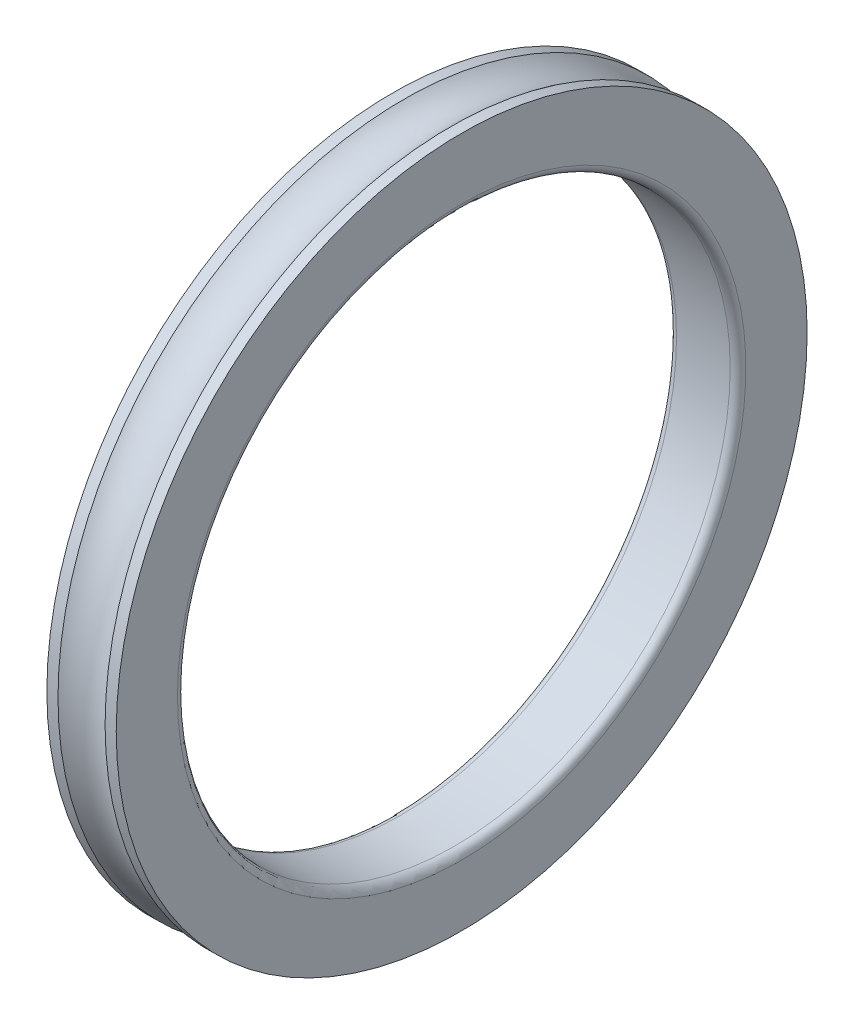
from build123d import *


with BuildPart() as part:
    # Sketch1 → Revolve1 (revolve)
    with BuildSketch(Plane.XY, mode=Mode.PRIVATE) as revolve1_sk:
        with BuildLine():
            Line((2.805064434, 27.94), (1.905, 27.94))
            ThreePointArc((1.905, 27.94), (0, 27.305), (-1.905, 27.94))
            Line((-1.905, 27.94), (-2.805064434, 27.94))
            Line((-2.805064434, 27.94), (-2.805064434, 22.987))
            ThreePointArc((-2.805064434, 22.987), (-2.61907724, 22.537987194), (-2.170064434, 22.352))
            Line((-2.170064434, 22.352), (2.170064434, 22.352))
            ThreePointArc((2.170064434, 22.352), (2.61907724, 22.537987194), (2.805064434, 22.987))
            Line((2.805064434, 22.987), (2.805064434, 27.94))
        make_face()
    revolve(revolve1_sk.sketch.rotate(Axis((-23.195066381, 0, 0), (1, 0, 0)), 90), axis=Axis((-23.195066381, 0, 0), (1, 0, 0)))


solid = part.part
